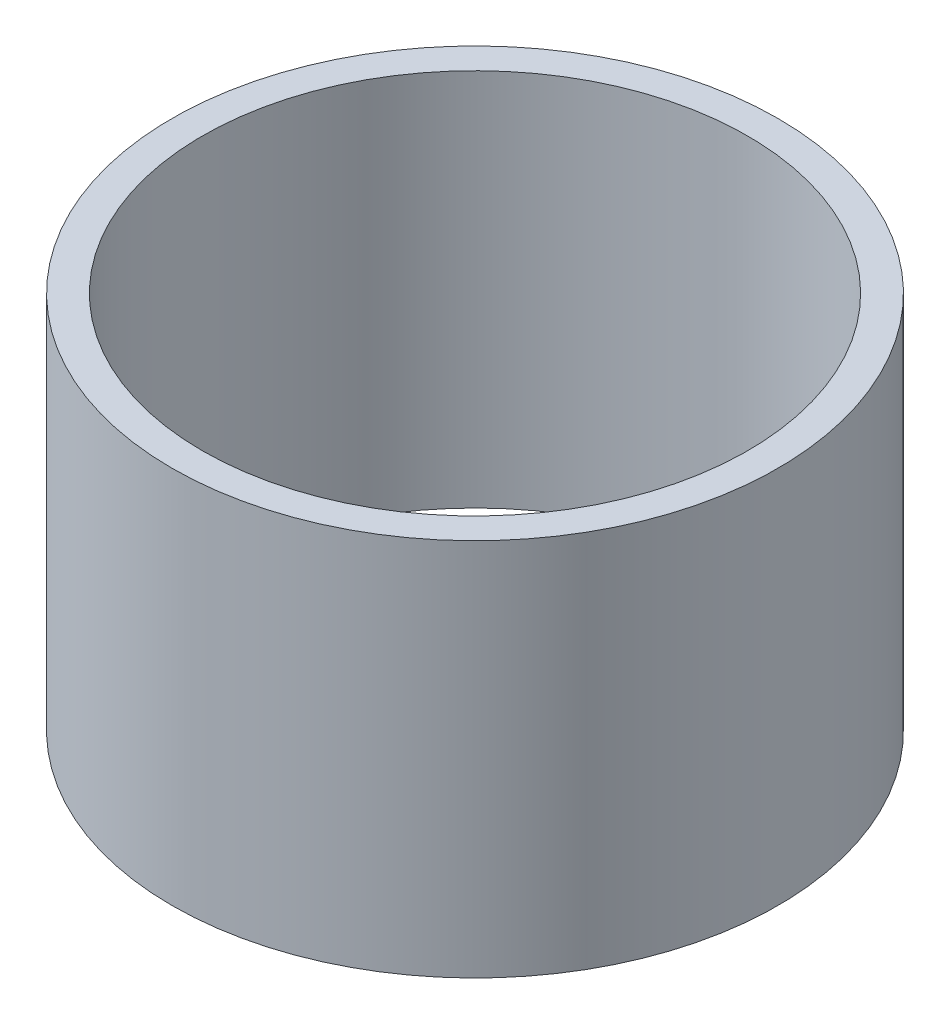
from build123d import *

# Parameters (mm, degrees)
SKETCH1_R           = 40
SKETCH1_R_2         = 36
BOSS_EXTRUDE1_DEPTH = 50


with BuildPart() as part:
    # Sketch1 → Boss-Extrude1 (new body)
    with BuildSketch(Plane(origin=(0, 0, 0), x_dir=(1, 0, 0), z_dir=(0, 1, 0))):
        with Locations(Location((0, 0, 0), (0, 0, 270))):
            Circle(SKETCH1_R)
        with Locations(Location((0, 0, 0), (0, 0, 270))):
            Circle(SKETCH1_R_2, mode=Mode.SUBTRACT)
    extrude(amount=BOSS_EXTRUDE1_DEPTH)


solid = part.part
